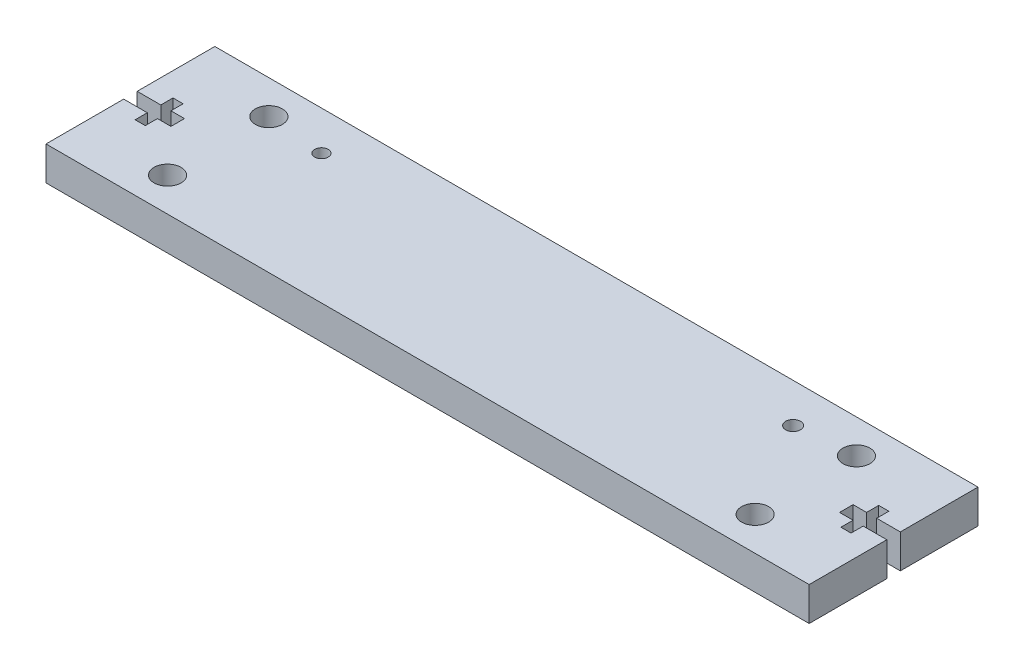
from build123d import *

# Parameters (mm, degrees)
ESBO_O1_W                = 113
ESBO_O1_H                = 25
RESSALTO_EXTRUS_O1_DEPTH = 5
CORTE_EXTRUS_O1_DEPTH    = 5
ESBO_O4_R                = 1
ESBO_O4_R_2              = 1.1
CORTE_EXTRUS_O2_DEPTH    = 76
ESBO_O5_R                = 2
CORTE_EXTRUS_O3_DEPTH    = 10


with BuildPart() as part:
    # Esboço1 → Ressalto-extrusão1 (new body)
    with BuildSketch(Plane(origin=(0, 0, 0), x_dir=(1, 0, 0), z_dir=(0, 1, 0))):
        with Locations((9.231716451, 5.983979594)):
            Rectangle(ESBO_O1_W, ESBO_O1_H)
    extrude(amount=RESSALTO_EXTRUS_O1_DEPTH)

    # Esboço2 → Corte-extrusão1 (cut)
    with BuildSketch(Plane(origin=(0, 5, 0), x_dir=(1, 0, 0), z_dir=(0, 1, 0))):
        Polygon((65.731716451, 4.983979594), (62.231716451, 4.983979594), (62.231716451, 3.183979594), (60.731716451, 3.183979594), (60.731716451, 4.983979594), (58.731716451, 4.983979594), (58.731716451, 6.983979594), (60.731716451, 6.983979594), (60.731716451, 8.783979594), (62.231716451, 8.783979594), (62.231716451, 6.983979594), (65.731716451, 6.983979594), align=None)
    corte_extrus_o1 = extrude(amount=-CORTE_EXTRUS_O1_DEPTH, mode=Mode.SUBTRACT)

    # Espelhar1: Corte-extrusão1 across plane
    add(corte_extrus_o1.mirror(Plane(origin=(9.231716451, 0, 0), x_dir=(0, 0, 1), z_dir=(1, 0, 0))), mode=Mode.SUBTRACT)

    # Esboço4 → Corte-extrusão2 (cut)
    with BuildSketch(Plane(origin=(0, 5, 0), x_dir=(1, 0, 0), z_dir=(0, 1, 0))):
        with Locations(Location((-25.688283549, 12.683979594, 0), (0, 0, 270))):
            Circle(ESBO_O4_R)
        with Locations(Location((44.151716451, 12.683979594, 0), (0, 0, 270))):
            Circle(ESBO_O4_R_2)
    extrude(amount=-CORTE_EXTRUS_O2_DEPTH, mode=Mode.SUBTRACT)

    # Esboço5 → Corte-extrusão3 (cut)
    with BuildSketch(Plane(origin=(0, 5, 0), x_dir=(1, 0, 0), z_dir=(0, 1, 0))):
        with Locations(Location((-34.268283549, 13.483979594, 0), (0, 0, 270))):
            Circle(ESBO_O5_R)
        with Locations(Location((-34.268283549, -1.516020406, 0), (0, 0, 270))):
            Circle(ESBO_O5_R)
        with Locations(Location((52.731716451, 13.483979594, 0), (0, 0, 270))):
            Circle(ESBO_O5_R)
        with Locations(Location((52.731716451, -1.516020406, 0), (0, 0, 270))):
            Circle(ESBO_O5_R)
    extrude(amount=-CORTE_EXTRUS_O3_DEPTH, mode=Mode.SUBTRACT)


solid = part.part
